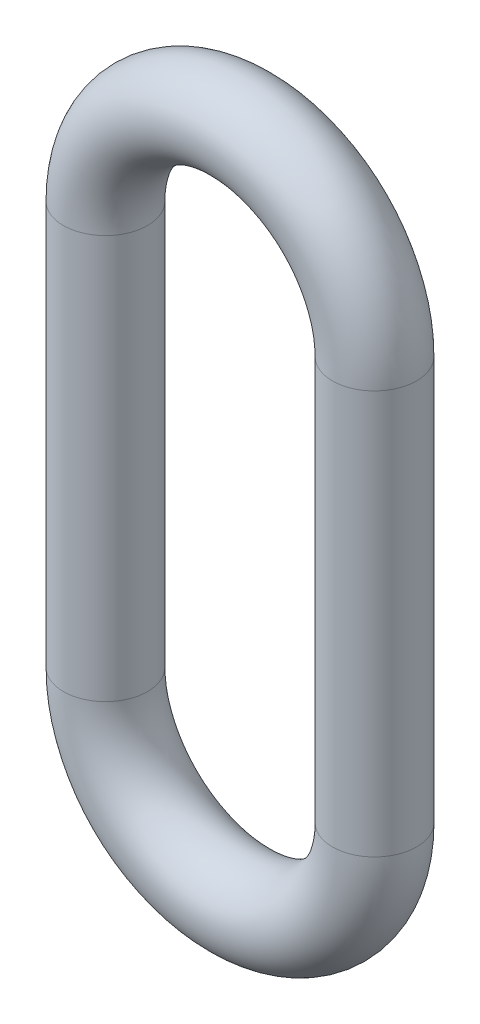
from build123d import *

# Parameters (mm, degrees)
SKETCH_2_R = 2.5


with BuildPart() as part:
    # По траектории1: sweep along a path in Эскиз1
    with BuildLine(Plane.XY) as sweep_1_path:
        Line((-8, 0), (-8, 24))
        ThreePointArc((-8, 24), (0, 32), (8, 24))
        Line((8, 24), (8, 0))
        ThreePointArc((8, 0), (0, -8), (-8, 0))
    # Эскиз2 → По траектории1 (sweep)
    with BuildSketch(Plane(origin=(0, 0, 0), x_dir=(1, 0, 0), z_dir=(0, 1, 0))):
        with Locations((-8, 0)):
            Circle(SKETCH_2_R)
    sweep(path=sweep_1_path.line)


solid = part.part
